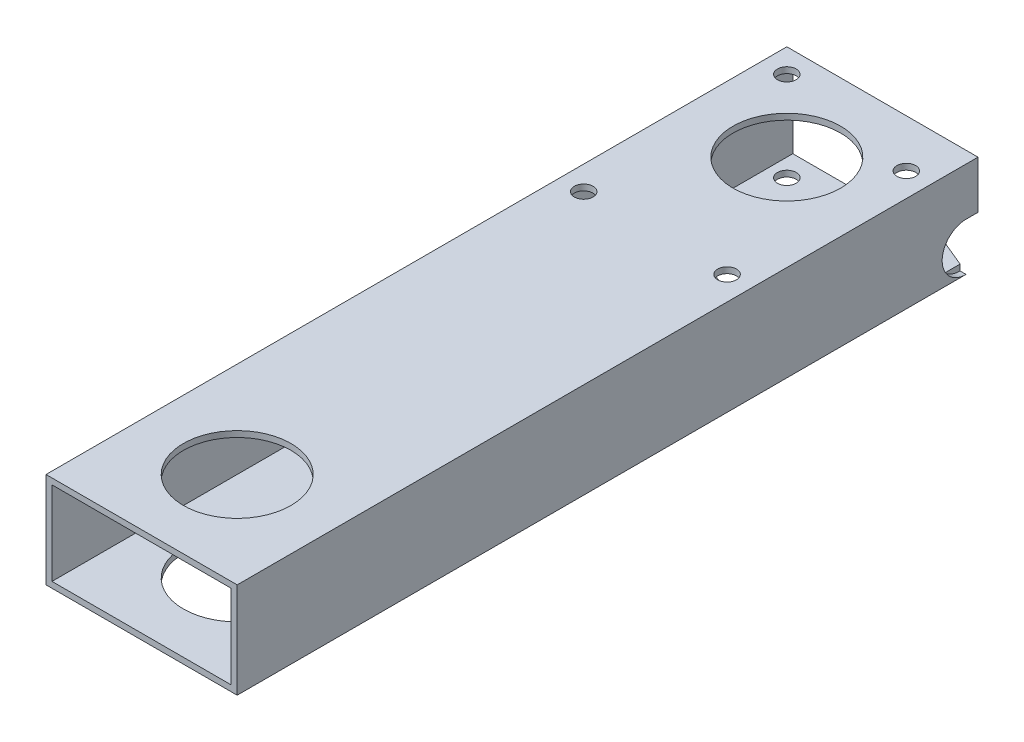
from build123d import *

# Parameters (mm, degrees)
BOSS_EXTRUDE1_DEPTH      = 98.424999
BOSS_EXTRUDE1_DEPTH_BACK = 98.424999
SKETCH3_W                = 50.8
SKETCH3_H                = 25.4
SKETCH3_W_2              = 47.625
SKETCH3_H_2              = 22.225
SKETCH4_R                = 14.2875
CUT_EXTRUDE3_DEPTH       = 105.774999061
CUT_EXTRUDE5_DEPTH       = 1.5875
CUT_EXTRUDE6_DEPTH       = 1.5875
F_10_CLEARANCE_HOLE1_D   = 4.9784


with BuildPart() as part:
    # Sketch3 → Boss-Extrude1 (new, two sides: drawn at the far end of the back side and taken through both)
    with BuildSketch(Plane.XY.offset(-BOSS_EXTRUDE1_DEPTH_BACK)):
        Rectangle(SKETCH3_W, SKETCH3_H)
        Rectangle(SKETCH3_W_2, SKETCH3_H_2, mode=Mode.SUBTRACT)
    extrude(amount=BOSS_EXTRUDE1_DEPTH + BOSS_EXTRUDE1_DEPTH_BACK)

    # Sketch4 → Cut-Extrude3 (cut, through all)
    with BuildSketch(Plane.XZ.offset(12.7)):
        with Locations((0, 73.025)):
            Circle(SKETCH4_R)
        with Locations((0, -73.025)):
            Circle(SKETCH4_R)
    extrude(amount=-CUT_EXTRUDE3_DEPTH, mode=Mode.SUBTRACT)

    # Sketch5 → Cut-Extrude5 (cut)
    with BuildSketch(Plane(origin=(25.4, 0, 0), x_dir=(0, 0, -1), z_dir=(1, 0, 0))):
        with BuildLine():
            Line((98.424999492, 0), (98.424999492, -12.7))
            Line((98.424999492, -12.7), (95.249999492, -12.7))
            ThreePointArc((95.249999492, -12.7), (88.899999492, -6.35), (95.249999492, 0))
            Line((95.249999492, 0), (98.424999492, 0))
        make_face()
    extrude(amount=-CUT_EXTRUDE5_DEPTH, mode=Mode.SUBTRACT)

    # Sketch6 → Cut-Extrude6 (cut)
    with BuildSketch(Plane.XZ.offset(12.7)):
        Polygon((23.8125, -98.424999492), (23.8125, -95.249999492), (16.1925, -98.424999492), align=None)
    extrude(amount=-CUT_EXTRUDE6_DEPTH, mode=Mode.SUBTRACT)

    # #10 Clearance Hole1 (through all)
    with Locations(Plane(origin=(0, -12.7, 0), x_dir=(-1, 0, 0), z_dir=(0, -1, 0))):
        with Locations((-19.05, 85.724999492), (19.05, 92.074999492), (19.05, 38.099999492), (-19.05, 38.099999492)):
            Hole(F_10_CLEARANCE_HOLE1_D / 2)


solid = part.part
